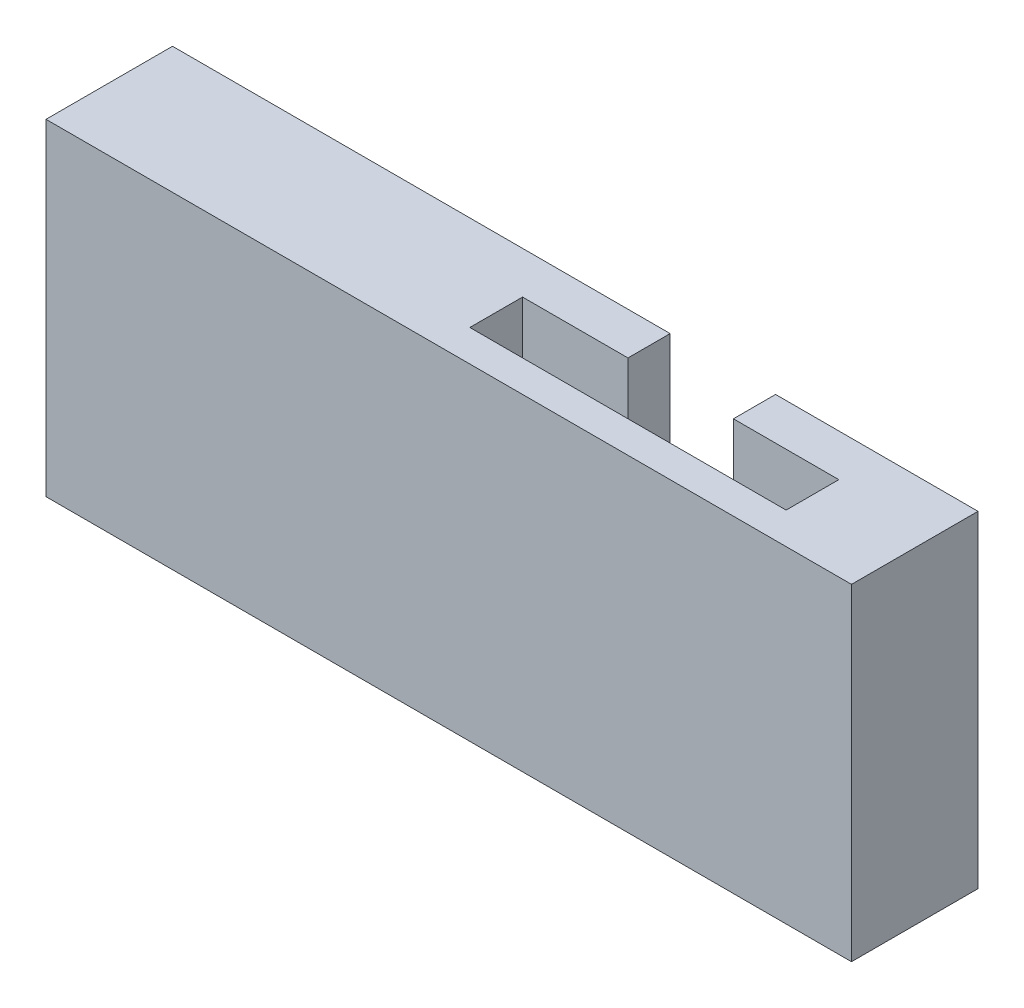
from build123d import *

# Parameters (mm, degrees)
SKETCH2_W           = 39
SKETCH2_H           = 15.5
BOSS_EXTRUDE1_DEPTH = 6
CUT_EXTRUDE1_DEPTH  = 12.5
SKETCH4_W           = 20.319843286
SKETCH4_H           = 28.236665345
CUT_EXTRUDE2_DEPTH  = 0.4
SKETCH5_W           = 11.083550883
SKETCH5_H           = 22.584934042
CUT_EXTRUDE3_DEPTH  = 0.4


with BuildPart() as part:
    # Sketch2 → Boss-Extrude1 (new body)
    with BuildSketch(Plane.XY):
        with Locations((19.5, 7.75)):
            Rectangle(SKETCH2_W, SKETCH2_H)
    extrude(amount=-BOSS_EXTRUDE1_DEPTH)

    # Sketch3 → Cut-Extrude1 (cut)
    with BuildSketch(Plane(origin=(0, 15.5, 0), x_dir=(1, 0, 0), z_dir=(0, 1, 0))):
        Polygon((24, 0), (24, 2), (19, 2), (19, 4.5), (34, 4.5), (34, 2), (29, 2), (29, 0), align=None)
    extrude(amount=-CUT_EXTRUDE1_DEPTH, mode=Mode.SUBTRACT)

    # Sketch4 → Cut-Extrude2 (cut)
    with BuildSketch(Plane(origin=(39, 0, 0), x_dir=(0, 0, -1), z_dir=(1, 0, 0))):
        with Locations((6.654932851, 5.177032831)):
            Rectangle(SKETCH4_W, SKETCH4_H)
    extrude(amount=-CUT_EXTRUDE2_DEPTH, mode=Mode.SUBTRACT)

    # Sketch5 → Cut-Extrude3 (cut)
    with BuildSketch(Plane.ZY):
        with Locations((-2.571172138, 7.134247173)):
            Rectangle(SKETCH5_W, SKETCH5_H)
    extrude(amount=-CUT_EXTRUDE3_DEPTH, mode=Mode.SUBTRACT)


with BuildPart() as body_2:
    # Mirror1: mirrored copy
    add(part.part.mirror(Plane(origin=(0, 0, -6), x_dir=(1, 0, 0), z_dir=(0, 0, -1))))


solid = body_2.part
